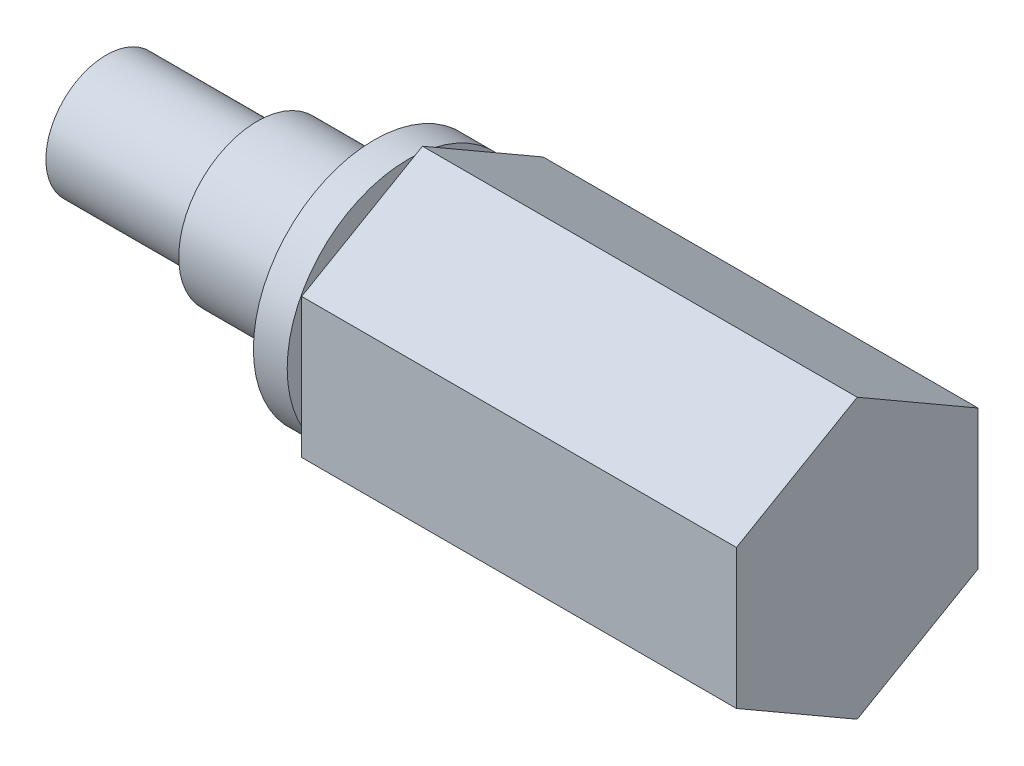
from build123d import *

# Parameters (mm, degrees)
BOSS_EXTRUDE1_DEPTH = 22.86


with BuildPart() as part:
    # Sketch1 → Revolve1 (revolve)
    with BuildSketch(Plane.XY, mode=Mode.PRIVATE) as revolve1_sk:
        Polygon((0, 0), (0, 6.35), (-22.86, 6.35), (-22.86, 5.241687437), (-23.622, 5.241687437), (-23.622, 6.35), (-25.4, 6.35), (-25.4, 4.1275), (-31.5468, 4.1275), (-31.5468, 3.175), (-39.4843, 3.175), (-39.4843, 0), align=None)
    revolve(revolve1_sk.sketch.rotate(Axis((0, 0, 0), (-1, 0, 0)), 90), axis=Axis((0, 0, 0), (-1, 0, 0)))

    # Sketch2 → Boss-Extrude1 (add)
    with BuildSketch(Plane(origin=(0, 0, 0), x_dir=(0, 0, -1), z_dir=(1, 0, 0))):
        Polygon((-6.35, 3.666174209), (-6.35, -3.666174209), (0, -7.332348419), (6.35, -3.666174209), (6.35, 3.666174209), (0, 7.332348419), align=None)
    extrude(amount=-BOSS_EXTRUDE1_DEPTH)


solid = part.part
